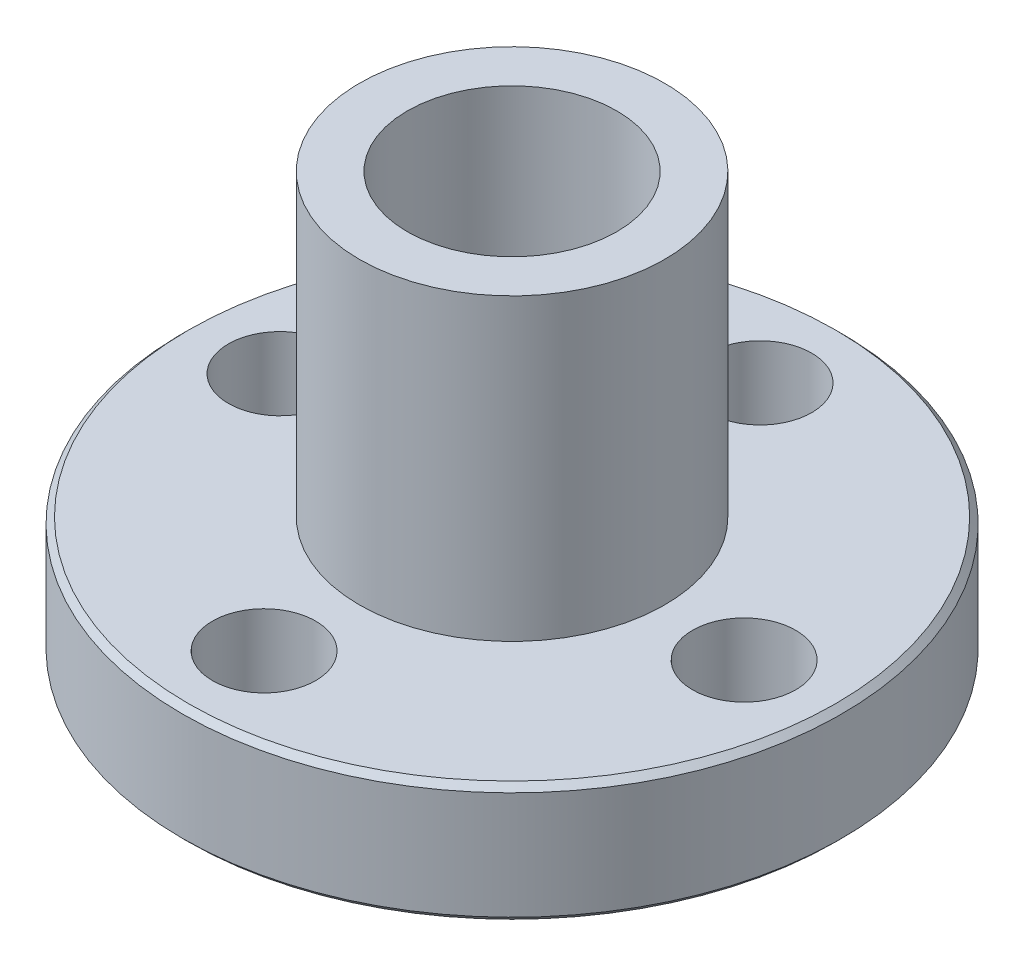
from build123d import *

# Parameters (mm, degrees)
SKETCH1_R           = 11.012952637
SKETCH1_R_2         = 3.5
BOSS_EXTRUDE1_DEPTH = 4
SKETCH2_R           = 1.725
CUT_EXTRUDE1_DEPTH  = 4
SKETCH3_R           = 5.1
SKETCH3_R_2         = 3.5
BOSS_EXTRUDE2_DEPTH = 10
BOSS_EXTRUDE3_START = 1.25
SKETCH4_R           = 5.125
SKETCH4_R_2         = 3.5
BOSS_EXTRUDE3_DEPTH = 1.25
CHAMFER1_SIZE       = 0.2


with BuildPart() as part:
    # Sketch1 → Boss-Extrude1 (new body)
    with BuildSketch(Plane(origin=(0, 0, 0), x_dir=(1, 0, 0), z_dir=(0, 1, 0))):
        with Locations(Location((0, 0, 0), (0, 0, 270))):
            Circle(SKETCH1_R)
        with Locations(Location((0, 0, 0), (0, 0, 270))):
            Circle(SKETCH1_R_2, mode=Mode.SUBTRACT)
    extrude(amount=BOSS_EXTRUDE1_DEPTH)

    # Sketch2 → Cut-Extrude1 (cut)
    with BuildSketch(Plane(origin=(0, 4, 0), x_dir=(1, 0, 0), z_dir=(0, 1, 0))):
        with Locations(Location((8.020580084, -0.266308323, 0), (0, 0, 270))):
            Circle(SKETCH2_R)
        with Locations(Location((-0.266308323, -8.020580084, 0), (0, 0, 270))):
            Circle(SKETCH2_R)
        with Locations(Location((-8.020580084, 0.266308323, 0), (0, 0, 270))):
            Circle(SKETCH2_R)
        with Locations(Location((0.266308323, 8.020580084, 0), (0, 0, 270))):
            Circle(SKETCH2_R)
    extrude(amount=-CUT_EXTRUDE1_DEPTH, mode=Mode.SUBTRACT)

    # Sketch3 → Boss-Extrude2 (add)
    with BuildSketch(Plane(origin=(0, 4, 0), x_dir=(1, 0, 0), z_dir=(0, 1, 0))):
        with Locations(Location((0, 0, 0), (0, 0, 270))):
            Circle(SKETCH3_R)
        with Locations(Location((0, 0, 0), (0, 0, 270))):
            Circle(SKETCH3_R_2, mode=Mode.SUBTRACT)
    extrude(amount=BOSS_EXTRUDE2_DEPTH)

    # Sketch4 → Boss-Extrude3 (add)
    with BuildSketch(Plane(origin=(0, 0, 0), x_dir=(-1, 0, 0), z_dir=(0, -1, 0)).offset(BOSS_EXTRUDE3_START)):
        with Locations(Location((0, 0, 0), (0, 0, 270))):
            Circle(SKETCH4_R)
        with Locations(Location((0, 0, 0), (0, 0, 90))):
            Circle(SKETCH4_R_2, mode=Mode.SUBTRACT)
    extrude(amount=-BOSS_EXTRUDE3_DEPTH)

    # Chamfer1
    chamfer1_edges = [part.edges().sort_by_distance(p)[0] for p in [
        (0, 0, -11.012952637),
        (0, 4, -11.012952637),
    ]]
    chamfer(chamfer1_edges, length=CHAMFER1_SIZE)


solid = part.part
